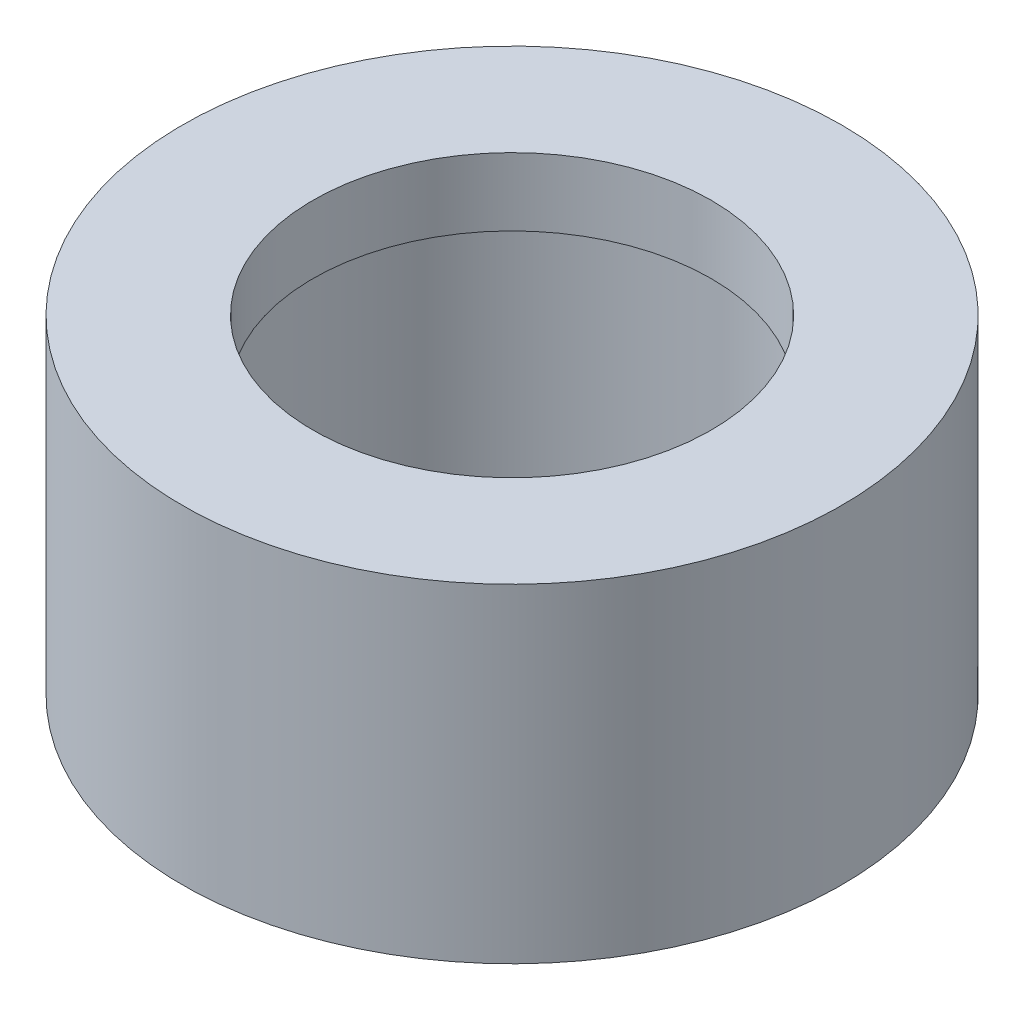
from build123d import *


with BuildPart() as part:
    # Sketch1 → Revolve1 (revolve)
    with BuildSketch(Plane(origin=(0, 0, 0), x_dir=(0, 0, -1), z_dir=(1, 0, 0))):
        Polygon((9.695024428, 0), (9.695024428, 3.302), (16.045024428, 3.302), (16.045024428, -12.7), (11.282524428, -12.7), (11.282524428, 0), align=None)
    revolve(axis=Axis((0, 0, 0), (0, 1, 0)))


solid = part.part
